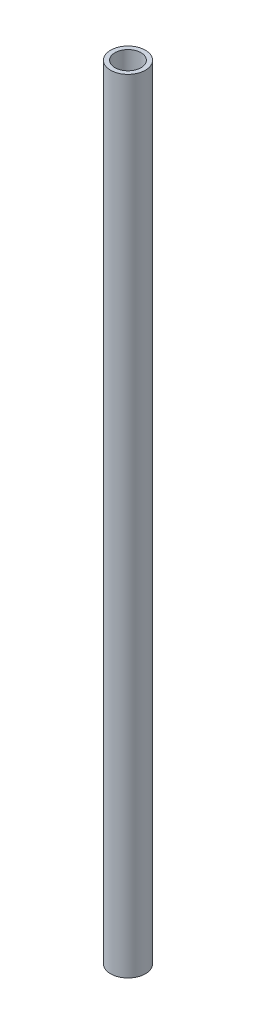
from build123d import *

# Parameters (mm, degrees)
SKETCH2_R   = 4
SKETCH2_R_2 = 3


with BuildPart() as part:
    # Sweep1: sweep along a path in Sketch1
    with BuildLine(Plane.XY) as sweep1_path:
        Line((0, 0), (0, 180))
    # Sketch2 → Sweep1 (sweep)
    with BuildSketch(Plane(origin=(0, 0, 0), x_dir=(1, 0, 0), z_dir=(0, 1, 0))):
        Circle(SKETCH2_R)
        Circle(SKETCH2_R_2, mode=Mode.SUBTRACT)
    sweep(path=sweep1_path.line)


solid = part.part
